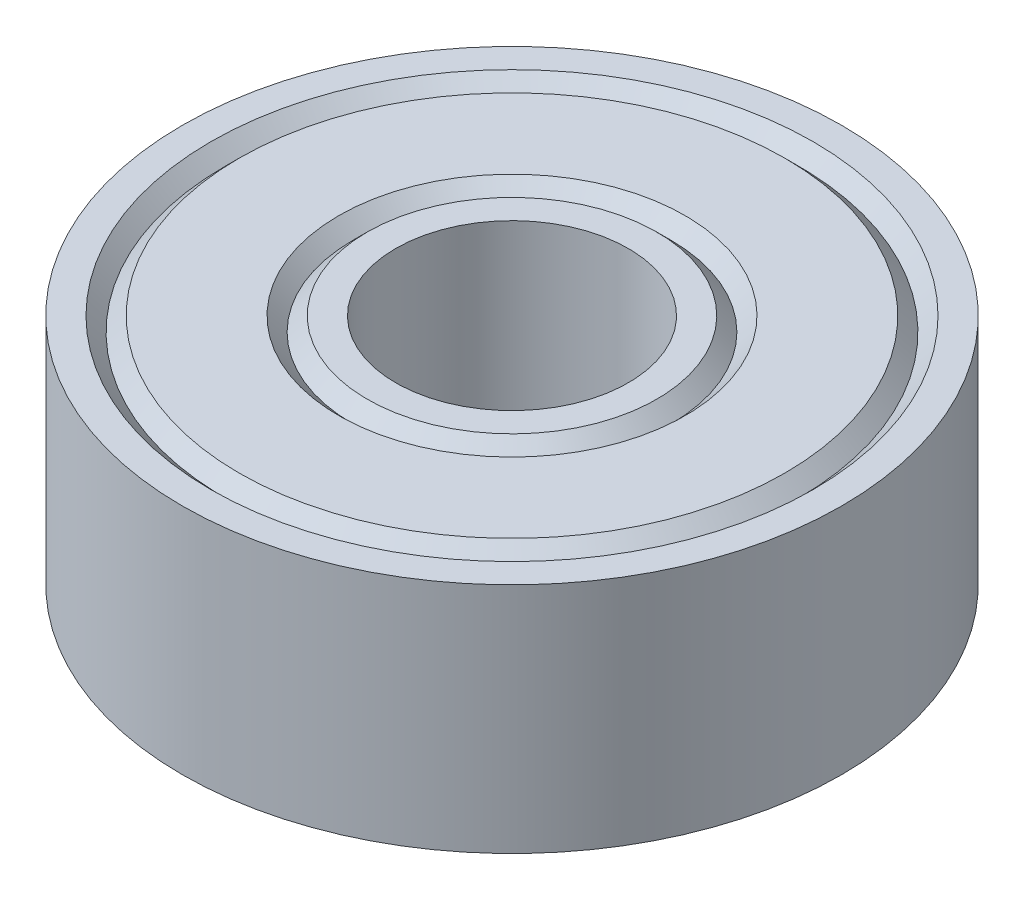
from build123d import *


with BuildPart() as part:
    # Sketch1 → Revolve1 (revolve)
    with BuildSketch(Plane.XY):
        Polygon((-3, 3), (-3.733333333, 3), (-4.1, 2.633333333), (-4.466666667, 3), (-7.033333333, 3), (-7.4, 2.633333333), (-7.766666667, 3), (-8.5, 3), (-8.5, -3), (-7.766666667, -3), (-7.4, -2.633333333), (-7.033333333, -3), (-4.466666667, -3), (-4.1, -2.633333333), (-3.733333333, -3), (-3, -3), align=None)
    revolve(axis=Axis((0, 3, 0), (0, -1, 0)))


solid = part.part
